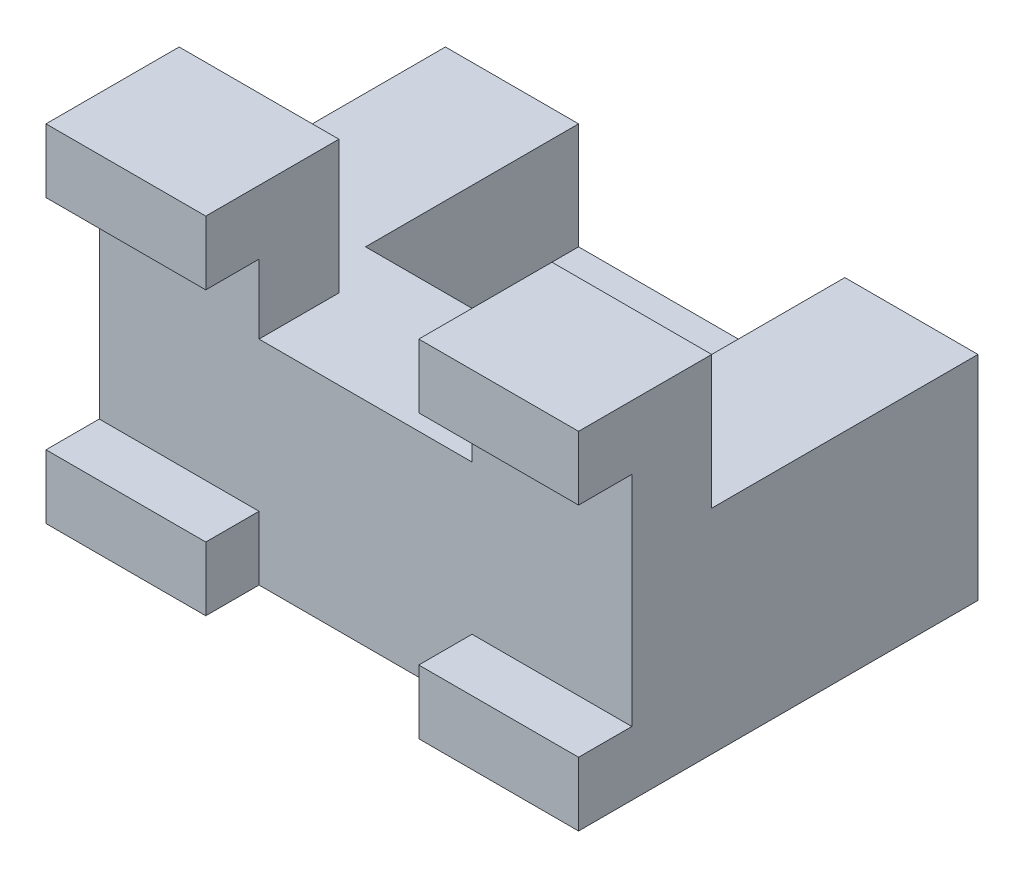
from build123d import *

# Parameters (mm, degrees)
BOSS_EXTRUDE1_DEPTH = 40
SKETCH1_3_W         = 50
SKETCH1_3_H         = 40
BOSS_EXTRUDE2_DEPTH = 20
SKETCH1_4_W         = 30
SKETCH1_4_H         = 25
BOSS_EXTRUDE3_DEPTH = 65
SKETCH2_W           = 10
SKETCH2_H           = 41
CUT_EXTRUDE1_DEPTH  = 141.890028036


with BuildPart() as part:
    # Sketch1 → Boss-Extrude1 (new body)
    with BuildSketch(Plane(origin=(0, 0, 0), x_dir=(1, 0, 0), z_dir=(0, 1, 0))):
        Polygon((0, 75), (0, 25), (30, 25), (30, 10), (70, 10), (70, 25), (100, 25), (100, 75), (75, 75), (75, 35), (25, 35), (25, 75), align=None)
    extrude(amount=BOSS_EXTRUDE1_DEPTH)

    # Sketch1<3> → Boss-Extrude2 (add)
    with BuildSketch(Plane(origin=(0, 0, 0), x_dir=(1, 0, 0), z_dir=(0, 1, 0))):
        with Locations((50, 55)):
            Rectangle(SKETCH1_3_W, SKETCH1_3_H)
    extrude(amount=BOSS_EXTRUDE2_DEPTH)

    # Sketch1<4> → Boss-Extrude3 (add)
    with BuildSketch(Plane(origin=(0, 0, 0), x_dir=(1, 0, 0), z_dir=(0, 1, 0))):
        with Locations((15, 12.5)):
            Rectangle(SKETCH1_4_W, SKETCH1_4_H)
        with Locations((85, 12.5)):
            Rectangle(SKETCH1_4_W, SKETCH1_4_H)
    extrude(amount=BOSS_EXTRUDE3_DEPTH)

    # Sketch2 → Cut-Extrude1 (cut, through all)
    with BuildSketch(Plane(origin=(100, 0, 0), x_dir=(0, 0, -1), z_dir=(1, 0, 0))):
        with Locations((5, 32.5)):
            Rectangle(SKETCH2_W, SKETCH2_H)
    extrude(amount=-CUT_EXTRUDE1_DEPTH, mode=Mode.SUBTRACT)


solid = part.part
